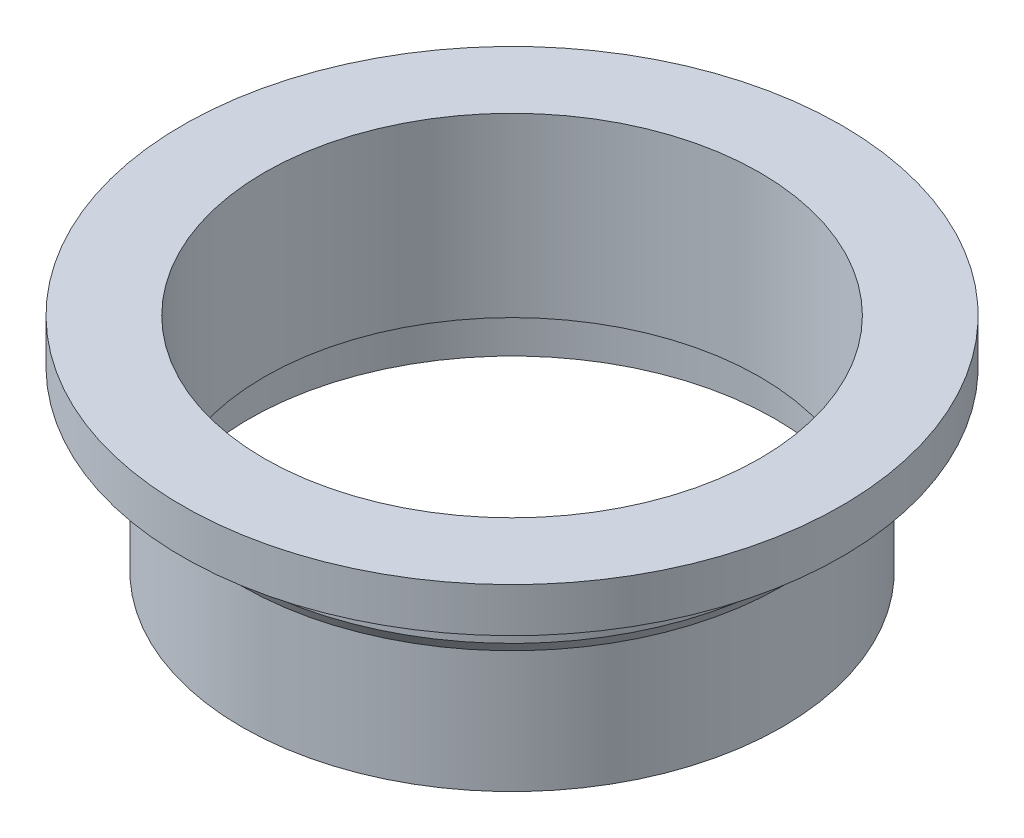
from build123d import *

# Parameters (mm, degrees)
BOSS_EXTRUDE1_DEPTH = 3
SKETCH4_R           = 59.5
SKETCH4_R_2         = 56
BOSS_EXTRUDE2_DEPTH = 40
FILLET1_R           = 1


with BuildPart() as part:
    # Sketch1 → Revolve1 (revolve)
    with BuildSketch(Plane.XY, mode=Mode.PRIVATE) as revolve1_sk:
        Polygon((59.5, 0), (59.5, 50), (74.5, 50), (74.5, 40), (63.839745962, 40), (62.5, 35), (62.5, 0), align=None)
    revolve(revolve1_sk.sketch.rotate(Axis((0, 0, 0), (0, 1, 0)), 90), axis=Axis((0, 0, 0), (0, 1, 0)))

    # Sketch3 → Boss-Extrude1 (add)
    with BuildSketch(Plane.XZ.offset(-40)):
        with BuildLine():
            Line((1.375, -72.486960034), (1.375, -62.5))
            Line((1.375, -62.5), (-1.375, -62.5))
            Line((-1.375, -62.5), (-1.375, -72.486960034))
            ThreePointArc((-1.375, -72.486960034), (0, -72.5), (1.375, -72.486960034))
        make_face()
    extrude(amount=BOSS_EXTRUDE1_DEPTH)

    # Sketch4 → Boss-Extrude2 (add)
    with BuildSketch(Plane(origin=(0, 50, 0), x_dir=(1, 0, 0), z_dir=(0, 1, 0))):
        with Locations(Location((0, 0, 0), (0, 0, 90))):
            Circle(SKETCH4_R)
        with Locations(Location((0, 0, 0), (0, 0, 270))):
            Circle(SKETCH4_R_2, mode=Mode.SUBTRACT)
    extrude(amount=-BOSS_EXTRUDE2_DEPTH)

    # Sketch5 → Cut-Revolve1 (revolve, cut)
    with BuildSketch(Plane.XY, mode=Mode.PRIVATE) as cut_revolve1_sk:
        Polygon((62.5, 30), (61.1, 27.575128869), (61.1, 0), (62.5, 0), align=None)
    revolve(cut_revolve1_sk.sketch.rotate(Axis((0, 50, 0), (0, -1, 0)), 268.750109895), axis=Axis((0, 50, 0), (0, -1, 0)), mode=Mode.SUBTRACT)

    # Fillet1
    fillet1_edges = [part.edges().sort_by_distance(p)[0] for p in [
        (-1.375, 38.5, -72.486960034),
        (1.375, 38.5, -72.486960034),
    ]]
    fillet(fillet1_edges, radius=FILLET1_R)


solid = part.part
